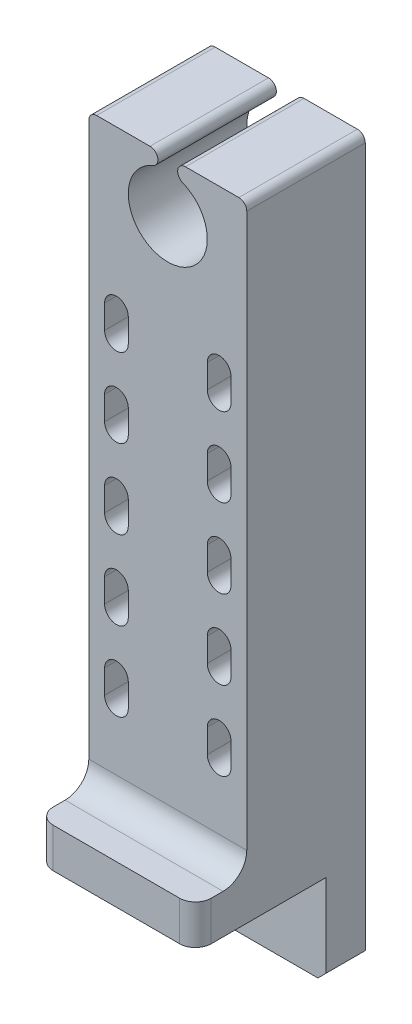
from build123d import *

# Parameters (mm, degrees)
P_IDAT_VYSUNUT_M1_DEPTH  = 15
ODEBRAT_VYSUNUT_M1_DEPTH = 82.091450741
LINPOLE1_COUNT           = 5
LINPOLE1_PITCH           = 10
SKICA3_W                 = 20
SKICA3_H                 = 5
P_IDAT_VYSUNUT_M2_DEPTH  = 11.5
ZKOSEN_1_SIZE            = 1
ZAOBLIT1_R               = 1
SKICA4_W                 = 20
SKICA4_H                 = 5
P_IDAT_VYSUNUT_M3_DEPTH  = 6.5
ZAOBLIT2_R               = 2
ZAOBLIT3_R               = 3


with BuildPart() as part:
    # Skica1 → Přidat vysunutím1 (new body)
    with BuildSketch(Plane.XY):
        with BuildLine():
            Line((-2.25, 79.062148865), (-10, 79.062148865))
            Line((-10, 79.062148865), (-10, 0))
            Line((-10, 0), (10, 0))
            Line((10, 0), (10, 79.062148865))
            Line((10, 79.062148865), (2.25, 79.062148865))
            ThreePointArc((2.25, 79.062148865), (1.268413323, 78.253166128), (1.875, 77.135124054))
            ThreePointArc((1.875, 77.135124054), (0, 67.5), (-1.875, 77.135124054))
            ThreePointArc((-1.875, 77.135124054), (-1.268413323, 78.253166128), (-2.25, 79.062148865))
        make_face()
    extrude(amount=P_IDAT_VYSUNUT_M1_DEPTH)

    # Skica2 → Odebrat vysunutím1 (cut, through all)
    with BuildSketch(Plane.XY.offset(15)):
        with BuildLine():
            Line((-8, 56), (-8, 59))
            ThreePointArc((-8, 59), (-6.5, 60.5), (-5, 59))
            Line((-5, 59), (-5, 56))
            ThreePointArc((-5, 56), (-6.5, 54.5), (-8, 56))
        make_face()
        with BuildLine():
            Line((5, 56), (5, 59))
            ThreePointArc((5, 59), (6.5, 60.5), (8, 59))
            Line((8, 59), (8, 56))
            ThreePointArc((8, 56), (6.5, 54.5), (5, 56))
        make_face()
    odebrat_vysunut_m1 = extrude(amount=-ODEBRAT_VYSUNUT_M1_DEPTH, mode=Mode.SUBTRACT)

    # LinPole1: Odebrat vysunutím1 ×5
    with Locations(*[(0, -i * LINPOLE1_PITCH, 0) for i in range(1, LINPOLE1_COUNT)]):
        add(odebrat_vysunut_m1, mode=Mode.SUBTRACT)

    # Skica3 → Přidat vysunutím2 (add)
    with BuildSketch(Plane.XZ):
        with Locations((0, 2.5)):
            Rectangle(SKICA3_W, SKICA3_H)
    extrude(amount=P_IDAT_VYSUNUT_M2_DEPTH)

    # Zkosení1
    zkosen_1_edges = [part.edges().sort_by_distance(p)[0] for p in [
        (-10, -11.5, 2.5),
        (10, -11.5, 2.5),
    ]]
    chamfer(zkosen_1_edges, length=ZKOSEN_1_SIZE)

    # Zaoblit1
    zaoblit1_edges = [part.edges().sort_by_distance(p)[0] for p in [
        (10, 79.062148865, 7.5),
        (-10, 79.062148865, 7.5),
    ]]
    fillet(zaoblit1_edges, radius=ZAOBLIT1_R)

    # Skica4 → Přidat vysunutím3 (add)
    with BuildSketch(Plane.XY.offset(15)):
        with Locations((0, 2.5)):
            Rectangle(SKICA4_W, SKICA4_H)
    extrude(amount=P_IDAT_VYSUNUT_M3_DEPTH)

    # Zaoblit2
    zaoblit2_edges = [part.edges().sort_by_distance(p)[0] for p in [
        (-10, 2.5, 21.5),
        (10, 2.5, 21.5),
    ]]
    fillet(zaoblit2_edges, radius=ZAOBLIT2_R)

    # Zaoblit3
    zaoblit3_edges = [part.edges().sort_by_distance(p)[0] for p in [
        (0, 5, 15),
    ]]
    fillet(zaoblit3_edges, radius=ZAOBLIT3_R)


solid = part.part
